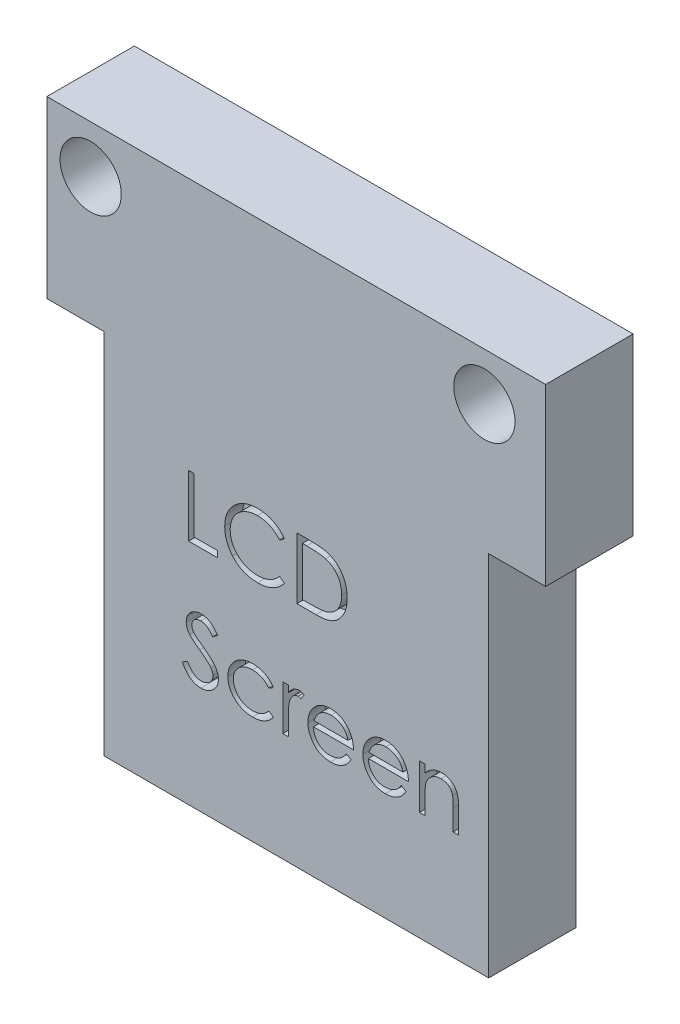
from build123d import *

# Parameters (mm, degrees)
SKETCH1_R           = 1.75
BOSS_EXTRUDE1_DEPTH = 5
CUT_EXTRUDE1_DEPTH  = 1


with BuildPart() as part:
    # Sketch1 → Boss-Extrude1 (new body)
    with BuildSketch(Plane.XY):
        Polygon((14.25, 15.5), (-14.25, 15.5), (-14.25, 5.5), (-11, 5.5), (-11, -15.5), (11, -15.5), (11, 5.5), (14.25, 5.5), align=None)
        with Locations((-11.75, 12.780701754)):
            Circle(SKETCH1_R, mode=Mode.SUBTRACT)
        with Locations((10.75, 12.780701754)):
            Circle(SKETCH1_R, mode=Mode.SUBTRACT)
    extrude(amount=BOSS_EXTRUDE1_DEPTH)

    # Sketch2 → Cut-Extrude1 (cut)
    # profile 1 of 9: a face of its own
    with BuildSketch(Plane.XY.offset(5)):
        Polygon((-6.152812215, 1.046333922), (-5.838709651, 1.046333922), (-5.838709651, -2.094691719), (-4.492555804, -2.094691719), (-4.492555804, -2.453666078), (-6.152812215, -2.453666078), align=None)
    # profile 2 of 9: a face of its own
    with BuildSketch(Plane.XY.offset(5)):
        with BuildLine():
            Line((-0.67845324, 0.404106357), (-0.953292984, 0.193769819))
            add(Edge.make_bspline(
                [(-0.953292984, 0.193769819), (-0.972898872, 0.217135789), (-1.011846319, 0.263552705), (-1.074505522, 0.328732249), (-1.139807164, 0.38979751), (-1.207726286, 0.44703939), (-1.279485405, 0.498456156), (-1.353346204, 0.546727259), (-1.430544249, 0.589994997), (-1.537295984, 0.642457983), (-1.676943832, 0.697204138), (-1.852738671, 0.743107369), (-2.03624977, 0.772328545), (-2.161447369, 0.775493386), (-2.22512792, 0.777103152)],
                knots=[0, 0, 0, 0, 0.757959112, 1.505699292, 2.245454638, 2.979532153, 3.711538275, 4.438200793, 5.171680507, 5.909471876, 7.393775596, 8.890124382, 10.418191784, 12, 12, 12, 12], degree=3))
            add(Edge.make_bspline(
                [(-2.22512792, 0.777103152), (-2.260211219, 0.77669919), (-2.330052212, 0.775895014), (-2.433700685, 0.765285889), (-2.535413736, 0.750374679), (-2.635125203, 0.728249356), (-2.732708161, 0.700276736), (-2.828800563, 0.666851323), (-2.922011163, 0.625496483), (-3.013629401, 0.579788223), (-3.101408612, 0.528160778), (-3.18446366, 0.471847426), (-3.262491628, 0.41147833), (-3.33555424, 0.346827223), (-3.403726188, 0.278185263), (-3.466513499, 0.204820921), (-3.523698909, 0.126968748), (-3.576415934, 0.04565534), (-3.623628668, -0.038882452), (-3.663158547, -0.126957522), (-3.698163669, -0.217061625), (-3.725862912, -0.310212786), (-3.747787429, -0.405755552), (-3.762915092, -0.50394634), (-3.773403563, -0.604580019), (-3.77420374, -0.672789332), (-3.774607086, -0.707171687)],
                knots=[0, 0, 0, 0, 1.054917814, 2.100044995, 3.131103042, 4.146048494, 5.169673617, 6.183595914, 7.203665975, 8.234915748, 9.262203917, 10.264457458, 11.251630812, 12.227803204, 13.197192746, 14.159520551, 15.12972552, 16.100847026, 17.073214652, 18.039054194, 19.002613845, 19.979014051, 20.95965708, 21.949030935, 22.966165397, 24, 24, 24, 24], degree=3))
            add(Edge.make_bspline(
                [(-3.774607086, -0.707171687), (-3.773345267, -0.758903007), (-3.770867853, -0.860470592), (-3.748819519, -1.009241203), (-3.715314428, -1.151761876), (-3.665098851, -1.287141719), (-3.6031798, -1.417050077), (-3.524939189, -1.53928893), (-3.434322651, -1.655705495), (-3.330048232, -1.763548443), (-3.215642416, -1.862062168), (-3.092894504, -1.948812749), (-2.962110217, -2.021127632), (-2.824733586, -2.081303578), (-2.679707472, -2.127560306), (-2.52729267, -2.160124429), (-2.367820675, -2.18136661), (-2.258851275, -2.183400298), (-2.203393144, -2.184435309)],
                knots=[0, 0, 0, 0, 1.029171465, 2.020641659, 2.987623507, 3.938342917, 4.889210282, 5.84687017, 6.821220943, 7.821438502, 8.827599549, 9.822697543, 10.807740252, 11.797342354, 12.80366471, 13.83203677, 14.896651826, 16, 16, 16, 16], degree=3))
            add(Edge.make_bspline(
                [(-2.203393144, -2.184435309), (-2.142290455, -2.182746529), (-2.022025746, -2.179422607), (-1.84565772, -2.151263358), (-1.676821954, -2.10560544), (-1.515509368, -2.041707518), (-1.362174721, -1.95864223), (-1.216578061, -1.857944352), (-1.078596491, -1.73865602), (-0.995625208, -1.647572891), (-0.953292984, -1.601101976)],
                knots=[0, 0, 0, 0, 1.028121516, 2.023589091, 2.998037872, 3.967518031, 4.937445131, 5.927275754, 6.942489185, 8, 8, 8, 8], degree=3))
            Line((-0.953292984, -1.601101976), (-0.67845324, -1.809335149))
            add(Edge.make_bspline(
                [(-0.67845324, -1.809335149), (-0.70057135, -1.837873601), (-0.744701625, -1.894813807), (-0.816159642, -1.975085517), (-0.89143694, -2.050589552), (-0.97109265, -2.120717174), (-1.054210441, -2.186871639), (-1.142282754, -2.24717347), (-1.234151786, -2.302464355), (-1.329506265, -2.353091279), (-1.428244878, -2.398008526), (-1.530249313, -2.436462294), (-1.635079888, -2.469587184), (-1.742741397, -2.49683912), (-1.853457154, -2.518110204), (-1.966827628, -2.532329879), (-2.083097503, -2.542071793), (-2.161538924, -2.542959709), (-2.201289779, -2.543409668)],
                knots=[0, 0, 0, 0, 0.986787822, 1.968848986, 2.935600012, 3.899624008, 4.868462664, 5.837806735, 6.815139263, 7.798259679, 8.787526145, 9.778297419, 10.776456485, 11.791383307, 12.812564526, 13.85620153, 14.913611965, 16, 16, 16, 16], degree=3))
            add(Edge.make_bspline(
                [(-2.201289779, -2.543409668), (-2.238933446, -2.543147676), (-2.313369136, -2.542629618), (-2.423267888, -2.53423745), (-2.530257468, -2.522787713), (-2.634032094, -2.505547582), (-2.735158069, -2.485203242), (-2.832718654, -2.457931986), (-2.927673864, -2.427382819), (-3.019642205, -2.391477832), (-3.108701905, -2.35096165), (-3.194565716, -2.305170091), (-3.277194148, -2.254488226), (-3.357399569, -2.200033216), (-3.433997153, -2.140055914), (-3.507650678, -2.075389279), (-3.578773154, -2.006251269), (-3.622775839, -1.956396415), (-3.644899554, -1.931330341)],
                knots=[0, 0, 0, 0, 1.114604814, 2.203992996, 3.262667896, 4.300477797, 5.318619304, 6.316056647, 7.298880507, 8.271930387, 9.238335007, 10.195173496, 11.151986948, 12.108099108, 13.064862484, 14.031167946, 15.010108607, 16, 16, 16, 16], degree=3))
            add(Edge.make_bspline(
                [(-3.644899554, -1.931330341), (-3.680335198, -1.887789152), (-3.750778675, -1.801232442), (-3.840904358, -1.660946461), (-3.918051913, -1.514478252), (-3.980427834, -1.361058323), (-4.029190567, -1.201030936), (-4.062971762, -1.034315421), (-4.084923367, -0.861067479), (-4.087433656, -0.74323069), (-4.088709651, -0.683333546)],
                knots=[0, 0, 0, 0, 0.994628077, 1.977248131, 2.950237994, 3.925870899, 4.908910175, 5.911660606, 6.938484602, 8, 8, 8, 8], degree=3))
            add(Edge.make_bspline(
                [(-4.088709651, -0.683333546), (-4.087154457, -0.620378093), (-4.084094711, -0.496517168), (-4.058098915, -0.314743215), (-4.016280119, -0.140591816), (-3.95688323, 0.025611928), (-3.881577879, 0.184742209), (-3.788551265, 0.335583414), (-3.678884123, 0.479100213), (-3.553436555, 0.613114965), (-3.41586922, 0.735654317), (-3.268550406, 0.843460521), (-3.111768459, 0.933178037), (-2.947250608, 1.008174199), (-2.773764926, 1.065818662), (-2.591681557, 1.106171849), (-2.401342642, 1.131288965), (-2.271480216, 1.134464173), (-2.20549651, 1.136077511)],
                knots=[0, 0, 0, 0, 1.032925535, 2.032216505, 3.007276963, 3.968222605, 4.92396291, 5.891752235, 6.871517503, 7.883894988, 8.900124299, 9.891468569, 10.874487609, 11.85992873, 12.854644235, 13.869047385, 14.917252991, 16, 16, 16, 16], degree=3))
            add(Edge.make_bspline(
                [(-2.20549651, 1.136077511), (-2.165282038, 1.135595373), (-2.08568154, 1.134641029), (-1.967928888, 1.125334887), (-1.853286561, 1.109821281), (-1.741675579, 1.088705211), (-1.632552963, 1.06249789), (-1.526752722, 1.028357591), (-1.423654035, 0.98932106), (-1.323907127, 0.944362594), (-1.227990577, 0.893895853), (-1.135934258, 0.838480229), (-1.048469399, 0.778184423), (-0.964980551, 0.713521248), (-0.88686434, 0.643122689), (-0.811902861, 0.568925093), (-0.742641783, 0.488791269), (-0.699888588, 0.432386335), (-0.67845324, 0.404106357)],
                knots=[0, 0, 0, 0, 1.096760587, 2.17092713, 3.219439832, 4.250915756, 5.268269357, 6.278326846, 7.281116186, 8.274029601, 9.260640565, 10.235837813, 11.203064059, 12.156899882, 13.114053108, 14.069676657, 15.032185724, 16, 16, 16, 16], degree=3))
        make_face()
    # profile 3 of 9: a face of its own
    with BuildSketch(Plane.XY.offset(5)):
        with BuildLine():
            Line((0.039495478, -2.453666078), (0.039495478, 1.046333922))
            Line((0.039495478, 1.046333922), (0.746226247, 1.046333922))
            add(Edge.make_bspline(
                [(0.746226247, 1.046333922), (0.807695235, 1.045891352), (0.926453, 1.045036309), (1.098065448, 1.039614918), (1.25684921, 1.030024452), (1.402282069, 1.016054926), (1.534763281, 0.998901892), (1.65392189, 0.977401488), (1.760374032, 0.952013317), (1.825843473, 0.930367867), (1.85680317, 0.920131999)],
                knots=[0, 0, 0, 0, 1.314313732, 2.53924729, 3.670748893, 4.714932338, 5.66265055, 6.526160246, 7.303039223, 8, 8, 8, 8], degree=3))
            add(Edge.make_bspline(
                [(1.85680317, 0.920131999), (1.897297909, 0.904701293), (1.977369102, 0.874189799), (2.091376224, 0.816633497), (2.198701587, 0.751420396), (2.299920732, 0.678464533), (2.392721558, 0.595700185), (2.480729455, 0.506643099), (2.560344179, 0.408054759), (2.633252475, 0.301979771), (2.698988134, 0.189667718), (2.756127292, 0.07133261), (2.803581286, -0.052424598), (2.842974512, -0.181259746), (2.87402097, -0.315456124), (2.895202901, -0.45516999), (2.909173891, -0.59984918), (2.910577943, -0.698023643), (2.911290349, -0.747836751)],
                knots=[0, 0, 0, 0, 0.984719456, 1.947108742, 2.898477687, 3.838006223, 4.779231079, 5.722358779, 6.681677486, 7.655904652, 8.64651281, 9.637519902, 10.640069247, 11.656948941, 12.698408672, 13.768548281, 14.867775369, 16, 16, 16, 16], degree=3))
            add(Edge.make_bspline(
                [(2.911290349, -0.747836751), (2.910661382, -0.79109799), (2.909421936, -0.876348779), (2.89829262, -1.001989675), (2.8821163, -1.123903246), (2.857072102, -1.241508946), (2.826669589, -1.355837164), (2.787705437, -1.465669408), (2.743069941, -1.572013217), (2.691020063, -1.673430693), (2.633878678, -1.769514066), (2.572556934, -1.860089594), (2.507120239, -1.943864816), (2.436944606, -2.021093428), (2.36293689, -2.091659006), (2.284612559, -2.156151021), (2.201769508, -2.213307576), (2.114778786, -2.265374685), (2.021102656, -2.31079504), (1.91896679, -2.34922505), (1.807935612, -2.381071665), (1.688281655, -2.407642561), (1.559798178, -2.428719864), (1.422359212, -2.442846256), (1.276175922, -2.452399189), (1.175796657, -2.453235582), (1.124130894, -2.453666078)],
                knots=[0, 0, 0, 0, 1.105936401, 2.179363191, 3.223086493, 4.248585256, 5.251745608, 6.245858792, 7.225916811, 8.198733463, 9.158002045, 10.082870192, 10.993790845, 11.873723703, 12.748670949, 13.606408763, 14.465103618, 15.319838547, 16.196477973, 17.123216899, 18.106603292, 19.147568657, 20.255746949, 21.433717677, 22.679120308, 24, 24, 24, 24], degree=3))
            Line((1.124130894, -2.453666078), (0.039495478, -2.453666078))
        make_face()
        with BuildLine():
            Line((0.353598042, -2.094691719), (0.75534083, -2.094691719))
            add(Edge.make_bspline(
                [(0.75534083, -2.094691719), (0.813069201, -2.094443623), (0.924101999, -2.093966443), (1.083759997, -2.08977924), (1.229639393, -2.082937302), (1.361760903, -2.073362224), (1.480049927, -2.060693609), (1.584753677, -2.046568707), (1.675528935, -2.028971256), (1.730458372, -2.013020296), (1.755841632, -2.005649251)],
                knots=[0, 0, 0, 0, 1.375205317, 2.645023457, 3.804390687, 4.853969522, 5.800190428, 6.637939096, 7.370582563, 8, 8, 8, 8], degree=3))
            add(Edge.make_bspline(
                [(1.755841632, -2.005649251), (1.787789994, -1.994397693), (1.850923632, -1.97216332), (1.941804717, -1.931605659), (2.026561722, -1.883563589), (2.106671747, -1.830161315), (2.180998402, -1.769515313), (2.250422519, -1.702944324), (2.31480432, -1.630109549), (2.373478628, -1.551101388), (2.425986932, -1.466411592), (2.471458161, -1.376872758), (2.511309693, -1.283465948), (2.542588286, -1.184756789), (2.56710387, -1.081627731), (2.584468558, -0.974071518), (2.595283282, -0.862108236), (2.59654473, -0.785956112), (2.597187785, -0.74713563)],
                knots=[0, 0, 0, 0, 0.998632004, 1.973411704, 2.929992603, 3.868527914, 4.809262121, 5.754881198, 6.702106254, 7.672490631, 8.653608572, 9.636854334, 10.631411391, 11.644891563, 12.686317036, 13.754757253, 14.855430412, 16, 16, 16, 16], degree=3))
            add(Edge.make_bspline(
                [(2.597187785, -0.74713563), (2.596674498, -0.706202149), (2.59566614, -0.625787965), (2.58299183, -0.50779727), (2.564470275, -0.394316619), (2.537686588, -0.285338424), (2.50355571, -0.180650072), (2.460961068, -0.080830561), (2.412294449, 0.015174307), (2.354391112, 0.105148673), (2.290975518, 0.190241782), (2.220597639, 0.268196698), (2.144375601, 0.339190998), (2.063140751, 0.404330311), (1.974603652, 0.460993987), (1.880849961, 0.511680668), (1.78050429, 0.554696559), (1.710691594, 0.577575422), (1.675212625, 0.589202511)],
                knots=[0, 0, 0, 0, 1.122418816, 2.205001699, 3.251619955, 4.274784885, 5.280384055, 6.268708349, 7.249350384, 8.229342522, 9.199999885, 10.157847722, 11.105861043, 12.055065948, 13.010012805, 13.98527497, 14.976112212, 16, 16, 16, 16], degree=3))
            add(Edge.make_bspline(
                [(1.675212625, 0.589202511), (1.645861479, 0.597318939), (1.583452888, 0.614576692), (1.481613424, 0.633402064), (1.366998275, 0.650006563), (1.239098574, 0.664064603), (1.098060115, 0.674151924), (0.943774427, 0.681723239), (0.776174822, 0.686829871), (0.659992288, 0.687178578), (0.599691792, 0.687359563)],
                knots=[0, 0, 0, 0, 0.674548936, 1.434276114, 2.292660221, 3.240891867, 4.284742987, 5.42552168, 6.663806718, 8, 8, 8, 8], degree=3))
            Line((0.599691792, 0.687359563), (0.353598042, 0.687359563))
            Line((0.353598042, 0.687359563), (0.353598042, -2.094691719))
        make_face(mode=Mode.SUBTRACT)
    # profile 4 of 9: a face of its own
    with BuildSketch(Plane.XY.offset(5)):
        with BuildLine():
            Line((-6.511786574, -8.611819123), (-6.215913176, -8.434435309))
            add(Edge.make_bspline(
                [(-6.215913176, -8.434435309), (-6.188394939, -8.480499694), (-6.135671058, -8.568757278), (-6.047719699, -8.688015318), (-5.956586788, -8.789377475), (-5.861597454, -8.872254083), (-5.763331506, -8.93750297), (-5.661147453, -8.983705201), (-5.555389642, -9.012521177), (-5.48341582, -9.016021263), (-5.447483689, -9.017768643)],
                knots=[0, 0, 0, 0, 1.272034388, 2.437168799, 3.508375237, 4.49857839, 5.41946034, 6.295179144, 7.148887113, 8, 8, 8, 8], degree=3))
            add(Edge.make_bspline(
                [(-5.447483689, -9.017768643), (-5.416796828, -9.01691397), (-5.355960055, -9.01521958), (-5.266397812, -8.998938778), (-5.17941601, -8.973926649), (-5.096807372, -8.938105717), (-5.019711758, -8.894767232), (-4.952105063, -8.842421054), (-4.893658949, -8.783814848), (-4.845849835, -8.718432194), (-4.8091698, -8.648115045), (-4.780977731, -8.575939094), (-4.765332658, -8.500770525), (-4.762975904, -8.450160063), (-4.761786574, -8.424619604)],
                knots=[0, 0, 0, 0, 1.095163259, 2.171163733, 3.241058638, 4.321873601, 5.38011039, 6.391990106, 7.366004449, 8.327778327, 9.272591725, 10.192022065, 11.087607919, 12, 12, 12, 12], degree=3))
            add(Edge.make_bspline(
                [(-4.761786574, -8.424619604), (-4.763260884, -8.395478754), (-4.766257943, -8.336239665), (-4.791589423, -8.248840012), (-4.831438669, -8.162347442), (-4.868201313, -8.108846177), (-4.887287375, -8.081069925)],
                knots=[0, 0, 0, 0, 0.938893495, 1.908633276, 2.914225137, 4, 4, 4, 4], degree=3))
            add(Edge.make_bspline(
                [(-4.887287375, -8.081069925), (-4.902957989, -8.061023101), (-4.935856483, -8.018937302), (-4.992413996, -7.956292067), (-5.05878011, -7.891673648), (-5.132683665, -7.822614591), (-5.216816754, -7.752326794), (-5.308544268, -7.677458516), (-5.410208127, -7.600856939), (-5.481507624, -7.549484374), (-5.51829699, -7.522976976)],
                knots=[0, 0, 0, 0, 0.722233717, 1.516239348, 2.393582979, 3.351407094, 4.387010283, 5.505090956, 6.712668013, 8, 8, 8, 8], degree=3))
            add(Edge.make_bspline(
                [(-5.51829699, -7.522976976), (-5.555120986, -7.496748388), (-5.625525663, -7.446601326), (-5.723984245, -7.372177042), (-5.812028708, -7.304133172), (-5.889267725, -7.24182916), (-5.955667322, -7.185256556), (-6.011750733, -7.134958616), (-6.05608929, -7.089575056), (-6.080744871, -7.060133714), (-6.091814618, -7.046915277)],
                knots=[0, 0, 0, 0, 1.452282411, 2.77665338, 3.964542531, 5.026858415, 5.96415736, 6.766646006, 7.446254459, 8, 8, 8, 8], degree=3))
            add(Edge.make_bspline(
                [(-6.091814618, -7.046915277), (-6.107287164, -7.02631424), (-6.137716, -6.985799537), (-6.177882006, -6.922474679), (-6.212021169, -6.857651413), (-6.238783501, -6.791155549), (-6.26131972, -6.72392062), (-6.27647765, -6.655069374), (-6.285969047, -6.584910756), (-6.286941034, -6.537697255), (-6.287427599, -6.514062713)],
                knots=[0, 0, 0, 0, 1.068054152, 2.10047183, 3.106115577, 4.101338837, 5.06977816, 6.043150881, 7.020423561, 8, 8, 8, 8], degree=3))
            add(Edge.make_bspline(
                [(-6.287427599, -6.514062713), (-6.28612239, -6.477032938), (-6.28353987, -6.403764875), (-6.261699353, -6.296734044), (-6.227226459, -6.194547627), (-6.178931571, -6.098217293), (-6.116674218, -6.010251312), (-6.044628244, -5.929637825), (-5.958816758, -5.861869243), (-5.864664135, -5.802657185), (-5.761607763, -5.75631126), (-5.653616859, -5.721350279), (-5.540519787, -5.701541022), (-5.463916652, -5.698698257), (-5.425047792, -5.697255822)],
                knots=[0, 0, 0, 0, 1.005424448, 1.989358655, 2.955360095, 3.929531133, 4.905563448, 5.876582895, 6.856512386, 7.866279853, 8.892233794, 9.918561126, 10.94386622, 12, 12, 12, 12], degree=3))
            add(Edge.make_bspline(
                [(-5.425047792, -5.697255822), (-5.383803691, -5.698678374), (-5.30178234, -5.701507375), (-5.181133124, -5.726104906), (-5.064972408, -5.766805578), (-4.971529143, -5.812994236), (-4.898396381, -5.859125652), (-4.842623649, -5.901145476), (-4.786106198, -5.949520584), (-4.728388143, -6.00437983), (-4.670447484, -6.066226582), (-4.611424031, -6.13463727), (-4.551179762, -6.209193826), (-4.512423902, -6.262418327), (-4.492555804, -6.289703739)],
                knots=[0, 0, 0, 0, 1.286793592, 2.559021753, 3.825965368, 5.121522368, 5.803751409, 6.523245864, 7.299691795, 8.125521123, 9.008227632, 9.944561021, 10.946284179, 12, 12, 12, 12], degree=3))
            Line((-4.492555804, -6.289703739), (-4.776510131, -6.50494813))
            add(Edge.make_bspline(
                [(-4.776510131, -6.50494813), (-4.793656064, -6.482859439), (-4.826675121, -6.440321786), (-4.876804608, -6.38075047), (-4.924053256, -6.326333991), (-4.970603655, -6.279068863), (-5.013997287, -6.23636673), (-5.056114329, -6.199806973), (-5.09634868, -6.169031377), (-5.147065591, -6.136187817), (-5.210783309, -6.103631314), (-5.290767846, -6.076082236), (-5.374354121, -6.059527174), (-5.431283752, -6.057338286), (-5.460103881, -6.056230181)],
                knots=[0, 0, 0, 0, 1.181633172, 2.275549214, 3.290209073, 4.226197932, 5.078386478, 5.862611352, 6.581680152, 7.217281963, 8.414376989, 9.595101626, 10.782541182, 12, 12, 12, 12], degree=3))
            add(Edge.make_bspline(
                [(-5.460103881, -6.056230181), (-5.496260404, -6.057441881), (-5.565984851, -6.05977853), (-5.664975087, -6.085298515), (-5.754069012, -6.125480376), (-5.830621577, -6.181795354), (-5.894358554, -6.248516347), (-5.940464013, -6.325295202), (-5.968214178, -6.410077604), (-5.971600457, -6.469219261), (-5.973325035, -6.499339155)],
                knots=[0, 0, 0, 0, 1.14458467, 2.207223713, 3.21896685, 4.227309161, 5.202851033, 6.127160689, 7.046193047, 8, 8, 8, 8], degree=3))
            add(Edge.make_bspline(
                [(-5.973325035, -6.499339155), (-5.972931909, -6.518090634), (-5.972145012, -6.555624253), (-5.961170215, -6.611075675), (-5.947070886, -6.666387015), (-5.924728254, -6.721309598), (-5.89388295, -6.776803957), (-5.853377774, -6.833825694), (-5.802364462, -6.892877403), (-5.76328745, -6.931284777), (-5.742655965, -6.951562713)],
                knots=[0, 0, 0, 0, 0.858281714, 1.717966888, 2.583508476, 3.4729293, 4.427298488, 5.488583878, 6.674047936, 8, 8, 8, 8], degree=3))
            add(Edge.make_bspline(
                [(-5.742655965, -6.951562713), (-5.734994592, -6.958399739), (-5.716792925, -6.974642947), (-5.683516999, -7.001235228), (-5.639574201, -7.034038), (-5.586112, -7.074625317), (-5.522144638, -7.121706779), (-5.447665082, -7.174680391), (-5.363503549, -7.23526585), (-5.303781633, -7.27762339), (-5.27220324, -7.300020245)],
                knots=[0, 0, 0, 0, 0.420754252, 0.999615792, 1.744751191, 2.668019286, 3.750313428, 4.999500688, 6.413464383, 8, 8, 8, 8], degree=3))
            add(Edge.make_bspline(
                [(-5.27220324, -7.300020245), (-5.234217327, -7.327661605), (-5.160662871, -7.381185266), (-5.056005291, -7.461600946), (-4.961111483, -7.540248715), (-4.875648279, -7.616626322), (-4.798771371, -7.690154415), (-4.73133365, -7.761717595), (-4.67264797, -7.830803168), (-4.609468751, -7.919375744), (-4.544910932, -8.028156828), (-4.489469424, -8.161435067), (-4.454511077, -8.295231387), (-4.449939561, -8.385158224), (-4.44768401, -8.429527457)],
                knots=[0, 0, 0, 0, 1.163667725, 2.253281268, 3.268753668, 4.215851969, 5.092017293, 5.902905408, 6.650798638, 7.335211899, 8.59617414, 9.77448103, 10.901945474, 12, 12, 12, 12], degree=3))
            add(Edge.make_bspline(
                [(-4.44768401, -8.429527457), (-4.448341148, -8.460905822), (-4.449642663, -8.523053205), (-4.464603576, -8.614308282), (-4.486523242, -8.702939152), (-4.519560476, -8.787850264), (-4.559883634, -8.870595027), (-4.611049882, -8.949002927), (-4.670357566, -9.024809326), (-4.738391331, -9.095992817), (-4.812837234, -9.161339013), (-4.891520928, -9.219468075), (-4.974571201, -9.267936398), (-5.061537518, -9.30748724), (-5.152439855, -9.338420758), (-5.247247639, -9.360833627), (-5.34611715, -9.374589338), (-5.413317631, -9.376017099), (-5.447483689, -9.376743001)],
                knots=[0, 0, 0, 0, 0.983748083, 1.948392443, 2.894712957, 3.844097841, 4.80183111, 5.778335162, 6.776009319, 7.81870978, 8.863265674, 9.881300176, 10.883814829, 11.87499822, 12.874611388, 13.892143829, 14.928324115, 16, 16, 16, 16], degree=3))
            add(Edge.make_bspline(
                [(-5.447483689, -9.376743001), (-5.473919032, -9.37623182), (-5.526456792, -9.375215895), (-5.604166274, -9.366234614), (-5.680305863, -9.35352751), (-5.753920145, -9.333353441), (-5.825957557, -9.308876463), (-5.896104791, -9.278738131), (-5.964395845, -9.242620929), (-6.031213428, -9.201325905), (-6.096387603, -9.15326816), (-6.159307071, -9.097294664), (-6.222036256, -9.034949159), (-6.282723652, -8.964538595), (-6.342596797, -8.887200513), (-6.400475206, -8.802211329), (-6.457556924, -8.710033975), (-6.493372392, -8.64516889), (-6.511786574, -8.611819123)],
                knots=[0, 0, 0, 0, 0.915332311, 1.819136955, 2.706846663, 3.586547465, 4.459518054, 5.340707479, 6.227863349, 7.133153174, 8.059268498, 9.028702269, 10.047606654, 11.120612155, 12.245963614, 13.433783089, 14.680604001, 16, 16, 16, 16], degree=3))
        make_face()
    # profile 5 of 9: a face of its own
    with BuildSketch(Plane.XY.offset(5)):
        with BuildLine():
            Line((-1.306658368, -7.283894444), (-1.569579042, -7.447255822))
            add(Edge.make_bspline(
                [(-1.569579042, -7.447255822), (-1.598408907, -7.411427428), (-1.655155602, -7.340905318), (-1.753694839, -7.249895385), (-1.858706253, -7.171728343), (-1.9719843, -7.108024592), (-2.093370101, -7.058803142), (-2.222384952, -7.023972936), (-2.359010457, -7.002268693), (-2.452675656, -6.999801856), (-2.500668785, -6.998537873)],
                knots=[0, 0, 0, 0, 1.026593902, 2.0206758, 2.988051866, 3.946915611, 4.916868779, 5.907761954, 6.927957743, 8, 8, 8, 8], degree=3))
            add(Edge.make_bspline(
                [(-2.500668785, -6.998537873), (-2.539027742, -6.999594715), (-2.614574665, -7.001676137), (-2.725480818, -7.014686631), (-2.831123171, -7.038328639), (-2.93216388, -7.069479596), (-3.027884299, -7.111229886), (-3.118535217, -7.162039642), (-3.204920707, -7.221089682), (-3.284537449, -7.289500228), (-3.357366456, -7.363898895), (-3.42046537, -7.443652591), (-3.475402303, -7.526372482), (-3.518508259, -7.614124224), (-3.55378343, -7.704900277), (-3.57699015, -7.800414133), (-3.592454845, -7.899442141), (-3.594224174, -7.96696048), (-3.595119907, -8.00114204)],
                knots=[0, 0, 0, 0, 1.112346261, 2.190735716, 3.231507886, 4.247384806, 5.251966152, 6.253067467, 7.256802811, 8.280671706, 9.291813951, 10.270744147, 11.225547591, 12.165006084, 13.100104208, 14.043489273, 15.009504848, 16, 16, 16, 16], degree=3))
            add(Edge.make_bspline(
                [(-3.595119907, -8.00114204), (-3.593340655, -8.045911251), (-3.589806124, -8.134846447), (-3.562104664, -8.266124549), (-3.516760257, -8.393048239), (-3.454702407, -8.514716376), (-3.376225272, -8.627310531), (-3.284052709, -8.728293986), (-3.178133626, -8.815710014), (-3.059401295, -8.888182539), (-2.930643551, -8.946443907), (-2.793253447, -8.987951239), (-2.648353666, -9.013003612), (-2.549146919, -9.016159555), (-2.49856542, -9.017768643)],
                knots=[0, 0, 0, 0, 0.966302908, 1.919585723, 2.883856336, 3.870342332, 4.860282998, 5.839159637, 6.814385684, 7.815993281, 8.834850808, 9.858348828, 10.908058873, 12, 12, 12, 12], degree=3))
            add(Edge.make_bspline(
                [(-2.49856542, -9.017768643), (-2.452210235, -9.016469145), (-2.361109997, -9.013915288), (-2.227942712, -8.992386325), (-2.101162801, -8.957142692), (-1.98077477, -8.907995042), (-1.866998604, -8.844467526), (-1.76056943, -8.766108355), (-1.659369491, -8.675171754), (-1.599872515, -8.604853783), (-1.569579042, -8.569050694)],
                knots=[0, 0, 0, 0, 1.039848629, 2.043578496, 3.018386758, 3.987534228, 4.954977003, 5.934852016, 6.948509513, 8, 8, 8, 8], degree=3))
            Line((-1.569579042, -8.569050694), (-1.306658368, -8.741526655))
            add(Edge.make_bspline(
                [(-1.306658368, -8.741526655), (-1.322246071, -8.764417382), (-1.353369738, -8.810122859), (-1.405397363, -8.874566976), (-1.461517195, -8.934888658), (-1.521510292, -8.991007048), (-1.584593301, -9.044265067), (-1.652921211, -9.092116642), (-1.724290823, -9.137251464), (-1.79953998, -9.177864337), (-1.877890678, -9.214370658), (-1.959232668, -9.245761829), (-2.043212481, -9.272731935), (-2.129928857, -9.294169282), (-2.219552755, -9.31128012), (-2.311852389, -9.322633822), (-2.406795971, -9.331109103), (-2.470968122, -9.33161497), (-2.503473272, -9.331871207)],
                knots=[0, 0, 0, 0, 0.954134338, 1.905101784, 2.851144739, 3.791306361, 4.734911809, 5.6936923, 6.663572882, 7.643865596, 8.638447847, 9.640600242, 10.646758161, 11.676244097, 12.717260333, 13.78922464, 14.880174919, 16, 16, 16, 16], degree=3))
            add(Edge.make_bspline(
                [(-2.503473272, -9.331871207), (-2.553084156, -9.330979927), (-2.650321848, -9.329233012), (-2.792644356, -9.310024537), (-2.928658023, -9.28106692), (-3.058316381, -9.239503186), (-3.181639615, -9.185998411), (-3.298512733, -9.120641497), (-3.408548752, -9.042889707), (-3.510659534, -8.954126937), (-3.604440981, -8.857886296), (-3.684967171, -8.754036378), (-3.754812441, -8.64639533), (-3.810899985, -8.532585804), (-3.855546911, -8.414120432), (-3.886051744, -8.290050192), (-3.905781481, -8.161397938), (-3.908064861, -8.073665056), (-3.909222471, -8.029186912)],
                knots=[0, 0, 0, 0, 1.1129367, 2.181364009, 3.217532258, 4.231199276, 5.232079859, 6.230262199, 7.231623845, 8.250719726, 9.263571943, 10.242672461, 11.195837495, 12.138959767, 13.085126421, 14.0317438, 15.002148558, 16, 16, 16, 16], degree=3))
            add(Edge.make_bspline(
                [(-3.909222471, -8.029186912), (-3.908781455, -7.999008477), (-3.907904201, -7.93897859), (-3.897842273, -7.849883523), (-3.8848438, -7.761974978), (-3.862818063, -7.676367259), (-3.837377432, -7.591761968), (-3.8049019, -7.509178867), (-3.766806505, -7.428234194), (-3.723554558, -7.349136465), (-3.674865812, -7.273186925), (-3.620984579, -7.201433261), (-3.563940243, -7.133013495), (-3.501064131, -7.070289734), (-3.435024477, -7.010753543), (-3.363952901, -6.955995419), (-3.28825705, -6.905854428), (-3.209073727, -6.859403412), (-3.126449016, -6.818043977), (-3.040882346, -6.782410739), (-2.952889316, -6.751958164), (-2.862329172, -6.727849244), (-2.769802999, -6.707631821), (-2.674581661, -6.694913975), (-2.577029439, -6.685927702), (-2.510973416, -6.68493691), (-2.477531766, -6.684435309)],
                knots=[0, 0, 0, 0, 0.990994727, 1.971252077, 2.943264845, 3.907940874, 4.872158414, 5.844625996, 6.82015047, 7.809835459, 8.804511986, 9.781214284, 10.756496977, 11.728388426, 12.696359165, 13.676225489, 14.672885716, 15.677705647, 16.690706858, 17.706033469, 18.721040654, 19.747369689, 20.783475414, 21.830280724, 22.901553713, 24, 24, 24, 24], degree=3))
            add(Edge.make_bspline(
                [(-2.477531766, -6.684435309), (-2.435651658, -6.6853572), (-2.352100778, -6.687196374), (-2.228160072, -6.702675027), (-2.106044878, -6.726011443), (-1.987897774, -6.760584273), (-1.87515126, -6.802447928), (-1.76961581, -6.849460643), (-1.673775706, -6.904055246), (-1.585848117, -6.963775361), (-1.505668599, -7.031136266), (-1.432414107, -7.106943224), (-1.364582457, -7.190801703), (-1.326125746, -7.252607434), (-1.306658368, -7.283894444)],
                knots=[0, 0, 0, 0, 1.095225653, 2.184976855, 3.262915854, 4.344593502, 5.400796181, 6.407717688, 7.363229445, 8.282371371, 9.184954523, 10.097238608, 11.036792983, 12, 12, 12, 12], degree=3))
        make_face()
    # profile 6 of 9: a face of its own
    with BuildSketch(Plane.XY.offset(5)):
        with BuildLine():
            Line((-0.76819683, -6.729307104), (-0.454094266, -6.729307104))
            Line((-0.454094266, -6.729307104), (-0.454094266, -7.105809508))
            add(Edge.make_bspline(
                [(-0.454094266, -7.105809508), (-0.430905507, -7.07075368), (-0.386557186, -7.00370968), (-0.312844257, -6.915040379), (-0.237340926, -6.841625333), (-0.159685738, -6.783121814), (-0.079307638, -6.739308695), (0.002029313, -6.70721566), (0.085604783, -6.688238345), (0.141766707, -6.685704686), (0.169904132, -6.684435309)],
                knots=[0, 0, 0, 0, 1.2804753, 2.448899062, 3.506932113, 4.484331642, 5.4025378, 6.288909075, 7.142734305, 8, 8, 8, 8], degree=3))
            add(Edge.make_bspline(
                [(0.169904132, -6.684435309), (0.191730458, -6.685625836), (0.236639543, -6.688075422), (0.304622133, -6.705286246), (0.374665585, -6.732764269), (0.419807972, -6.758604491), (0.443341632, -6.772075534)],
                knots=[0, 0, 0, 0, 0.901110191, 1.854092781, 2.881294221, 4, 4, 4, 4], degree=3))
            Line((0.443341632, -6.772075534), (0.27086567, -7.04411079))
            add(Edge.make_bspline(
                [(0.27086567, -7.04411079), (0.255756649, -7.037370524), (0.227076834, -7.024576208), (0.185122268, -7.009434198), (0.146440931, -7.000518282), (0.121797373, -6.999167565), (0.110308779, -6.998537873)],
                knots=[0, 0, 0, 0, 1.180555205, 2.24091978, 3.179933427, 4, 4, 4, 4], degree=3))
            add(Edge.make_bspline(
                [(0.110308779, -6.998537873), (0.085103045, -7.000217911), (0.033690655, -7.0036447), (-0.041793844, -7.030583508), (-0.115041049, -7.074108748), (-0.173212712, -7.12237986), (-0.218254965, -7.168927657), (-0.25039519, -7.20957606), (-0.279877937, -7.255154691), (-0.308048158, -7.304884375), (-0.333714452, -7.359614221), (-0.357669121, -7.418797434), (-0.379327984, -7.482502563), (-0.391678228, -7.526885083), (-0.398004522, -7.549619604)],
                knots=[0, 0, 0, 0, 1.125678352, 2.296057538, 3.5422874, 4.923748041, 5.663163013, 6.437101912, 7.23742474, 8.08941207, 8.991984279, 9.93940061, 10.944477711, 12, 12, 12, 12], degree=3))
            add(Edge.make_bspline(
                [(-0.398004522, -7.549619604), (-0.402736916, -7.569896778), (-0.413218807, -7.614809176), (-0.423410345, -7.690157701), (-0.433479863, -7.77918136), (-0.440576482, -7.882127953), (-0.447154524, -7.998740397), (-0.450864606, -8.129196342), (-0.453967746, -8.273629693), (-0.454050813, -8.374604047), (-0.454094266, -8.427424091)],
                knots=[0, 0, 0, 0, 0.566838948, 1.255505196, 2.06880316, 3.007127437, 4.065329342, 5.249902469, 6.561414163, 8, 8, 8, 8], degree=3))
            Line((-0.454094266, -8.427424091), (-0.454094266, -9.286999412))
            Line((-0.454094266, -9.286999412), (-0.76819683, -9.286999412))
            Line((-0.76819683, -9.286999412), (-0.76819683, -6.729307104))
        make_face()
    # profile 7 of 9: a face of its own
    with BuildSketch(Plane.XY.offset(5)):
        with BuildLine():
            Line((2.856602849, -8.479307104), (3.135649324, -8.625841559))
            add(Edge.make_bspline(
                [(3.135649324, -8.625841559), (3.113412729, -8.66528489), (3.07014912, -8.742025993), (2.995748372, -8.847457854), (2.9177563, -8.94230557), (2.832652332, -9.024035224), (2.742982653, -9.095286609), (2.648249998, -9.157624434), (2.54796118, -9.210742954), (2.442111455, -9.255495482), (2.329811904, -9.289904976), (2.210790388, -9.314209197), (2.084818892, -9.329232465), (1.998472713, -9.330977606), (1.954259099, -9.331871207)],
                knots=[0, 0, 0, 0, 1.120438281, 2.179929193, 3.190490725, 4.156257408, 5.095198341, 6.022838206, 6.959905092, 7.901321166, 8.864066838, 9.862729781, 10.905609505, 12, 12, 12, 12], degree=3))
            add(Edge.make_bspline(
                [(1.954259099, -9.331871207), (1.905117122, -9.330724031), (1.80925536, -9.328486225), (1.669715613, -9.30919376), (1.538336195, -9.277721401), (1.415124491, -9.23375586), (1.300382239, -9.176328536), (1.193881384, -9.106369054), (1.095061858, -9.024236799), (1.007037649, -8.929220356), (0.927793766, -8.827538399), (0.857867946, -8.721582514), (0.799410515, -8.61161929), (0.751857905, -8.498348766), (0.71345304, -8.382484872), (0.686686336, -8.262973404), (0.671256588, -8.14013782), (0.668892143, -8.057040485), (0.667700606, -8.015164476)],
                knots=[0, 0, 0, 0, 1.145258523, 2.234067595, 3.276747158, 4.290159414, 5.277019952, 6.260822364, 7.254936242, 8.264827045, 9.274100331, 10.257902744, 11.220704747, 12.172965371, 13.118907548, 14.062713208, 15.023725156, 16, 16, 16, 16], degree=3))
            add(Edge.make_bspline(
                [(0.667700606, -8.015164476), (0.668759747, -7.975869645), (0.670858825, -7.897992481), (0.684089613, -7.782726936), (0.707537906, -7.670698484), (0.73971423, -7.561814036), (0.781265476, -7.456255902), (0.832097695, -7.353959838), (0.892290073, -7.255034698), (0.938762747, -7.192631565), (0.96217176, -7.16119813)],
                knots=[0, 0, 0, 0, 1.024358464, 2.0301432, 3.019427413, 4.004406732, 4.986367066, 5.972626655, 6.978780325, 8, 8, 8, 8], degree=3))
            add(Edge.make_bspline(
                [(0.96217176, -7.16119813), (0.993879442, -7.12332926), (1.056290389, -7.048791109), (1.161846744, -6.950852783), (1.276146941, -6.868809008), (1.397758567, -6.800801872), (1.528095041, -6.749128225), (1.665404332, -6.710620643), (1.811249918, -6.689042632), (1.910955139, -6.685994798), (1.961971439, -6.684435309)],
                knots=[0, 0, 0, 0, 1.030682036, 2.02871468, 2.997146059, 3.962720338, 4.930598197, 5.918074684, 6.934738563, 8, 8, 8, 8], degree=3))
            add(Edge.make_bspline(
                [(1.961971439, -6.684435309), (2.014419045, -6.685789358), (2.11730929, -6.688445693), (2.267341411, -6.713072027), (2.409302128, -6.752124581), (2.543134632, -6.807278372), (2.668852493, -6.878437924), (2.785638543, -6.966579765), (2.895490055, -7.068997852), (2.959398634, -7.147761062), (2.991919356, -7.187840758)],
                knots=[0, 0, 0, 0, 1.056321875, 2.072262726, 3.055038591, 4.01806755, 4.982017516, 5.957941055, 6.960871419, 8, 8, 8, 8], degree=3))
            add(Edge.make_bspline(
                [(2.991919356, -7.187840758), (3.014046294, -7.218044339), (3.058152887, -7.278250458), (3.113399987, -7.376421615), (3.161357382, -7.479132209), (3.199690343, -7.588042507), (3.230729845, -7.701862087), (3.253186663, -7.821404631), (3.266356282, -7.946634543), (3.268944979, -8.031961098), (3.270264708, -8.07546095)],
                knots=[0, 0, 0, 0, 0.94817472, 1.890038105, 2.849395472, 3.817997239, 4.812318967, 5.836947057, 6.897266129, 8, 8, 8, 8], degree=3))
            Line((3.270264708, -8.07546095), (0.98180317, -8.07546095))
            add(Edge.make_bspline(
                [(0.98180317, -8.07546095), (0.983342776, -8.109161414), (0.98637035, -8.175432018), (1.000485494, -8.272402801), (1.022734267, -8.364776143), (1.05400333, -8.451859185), (1.091870175, -8.534789313), (1.138255892, -8.61295135), (1.193595446, -8.68598928), (1.255321145, -8.754556418), (1.324028241, -8.815617179), (1.396310988, -8.870268955), (1.473204553, -8.916074552), (1.554102636, -8.953254441), (1.638874421, -8.982360757), (1.727546617, -9.002228578), (1.819944733, -9.015535685), (1.882930467, -9.01701535), (1.914996279, -9.017768643)],
                knots=[0, 0, 0, 0, 1.094153842, 2.151609401, 3.174256925, 4.172055639, 5.149267565, 6.128595816, 7.11444997, 8.118368179, 9.117203808, 10.09244225, 11.054858984, 12.015122123, 12.976791628, 13.957293641, 14.960065497, 16, 16, 16, 16], degree=3))
            add(Edge.make_bspline(
                [(1.914996279, -9.017768643), (1.946347427, -9.017160586), (2.008554117, -9.015954085), (2.101194975, -9.004222174), (2.192334502, -8.985251898), (2.281595485, -8.959361908), (2.367166331, -8.927785056), (2.446411881, -8.889682198), (2.519292097, -8.847532452), (2.587409064, -8.799322777), (2.653480057, -8.74031459), (2.719022543, -8.666678869), (2.789299197, -8.579591341), (2.83328879, -8.514045675), (2.856602849, -8.479307104)],
                knots=[0, 0, 0, 0, 0.99110716, 1.966546729, 2.947904876, 3.932708344, 4.903319531, 5.828989031, 6.710028674, 7.56322171, 8.463672341, 9.504779593, 10.677557249, 12, 12, 12, 12], degree=3))
        make_face()
        with BuildLine():
            add(Edge.make_bspline(
                [(2.956162144, -7.761358386), (2.94466552, -7.719695512), (2.922538218, -7.639507892), (2.876301854, -7.528467001), (2.824230313, -7.4297791), (2.762608582, -7.344199467), (2.692789856, -7.268195954), (2.612144674, -7.201777369), (2.52170878, -7.142359918), (2.421949639, -7.092207419), (2.316307854, -7.04951756), (2.205701662, -7.020892444), (2.092843874, -7.001282902), (2.016509588, -6.999456793), (1.97809724, -6.998537873)],
                knots=[0, 0, 0, 0, 1.154881502, 2.222775134, 3.210006277, 4.132804581, 5.035138423, 5.962687519, 6.919655026, 7.923214229, 8.944639381, 9.960483929, 10.97369054, 12, 12, 12, 12], degree=3))
            add(Edge.make_bspline(
                [(1.97809724, -6.998537873), (1.946747802, -6.999149545), (1.884776553, -7.000358691), (1.793475485, -7.01182882), (1.705795786, -7.030788665), (1.621090498, -7.056753622), (1.54046963, -7.091362224), (1.462274862, -7.131945451), (1.388494465, -7.181487035), (1.34235317, -7.219245889), (1.319042753, -7.238321527)],
                knots=[0, 0, 0, 0, 1.04873581, 2.073130211, 3.073294108, 4.04793562, 5.032784715, 6.005352987, 6.992311501, 8, 8, 8, 8], degree=3))
            add(Edge.make_bspline(
                [(1.319042753, -7.238321527), (1.302349471, -7.253415843), (1.268566337, -7.283963059), (1.223425816, -7.336592265), (1.180205343, -7.393343828), (1.14087169, -7.456388952), (1.104794104, -7.525009731), (1.071034127, -7.598627366), (1.040647714, -7.677800497), (1.023551604, -7.732972936), (1.014755894, -7.761358386)],
                knots=[0, 0, 0, 0, 0.879870761, 1.780643979, 2.707998968, 3.669668524, 4.684282772, 5.740141944, 6.837334558, 8, 8, 8, 8], degree=3))
            Line((1.014755894, -7.761358386), (2.956162144, -7.761358386))
        make_face(mode=Mode.SUBTRACT)
    # profile 8 of 9: a face of its own
    with BuildSketch(Plane.XY.offset(5)):
        with BuildLine():
            Line((5.99762849, -8.479307104), (6.276674965, -8.625841559))
            add(Edge.make_bspline(
                [(6.276674965, -8.625841559), (6.25443837, -8.66528489), (6.211174761, -8.742025993), (6.136774013, -8.847457854), (6.058781941, -8.94230557), (5.973677973, -9.024035224), (5.884008294, -9.095286609), (5.789275639, -9.157624434), (5.688986821, -9.210742954), (5.583137096, -9.255495482), (5.470837545, -9.289904976), (5.351816029, -9.314209197), (5.225844533, -9.329232465), (5.139498354, -9.330977606), (5.09528474, -9.331871207)],
                knots=[0, 0, 0, 0, 1.120438281, 2.179929193, 3.190490725, 4.156257408, 5.095198341, 6.022838206, 6.959905092, 7.901321166, 8.864066838, 9.862729781, 10.905609505, 12, 12, 12, 12], degree=3))
            add(Edge.make_bspline(
                [(5.09528474, -9.331871207), (5.046142763, -9.330724031), (4.950281001, -9.328486225), (4.810741254, -9.30919376), (4.679361836, -9.277721401), (4.556150132, -9.23375586), (4.44140788, -9.176328536), (4.334907025, -9.106369054), (4.236087499, -9.024236799), (4.14806329, -8.929220356), (4.068819407, -8.827538399), (3.998893587, -8.721582514), (3.940436156, -8.61161929), (3.892883546, -8.498348766), (3.854478681, -8.382484872), (3.827711977, -8.262973404), (3.812282229, -8.14013782), (3.809917784, -8.057040485), (3.808726247, -8.015164476)],
                knots=[0, 0, 0, 0, 1.145258523, 2.234067595, 3.276747158, 4.290159414, 5.277019952, 6.260822364, 7.254936242, 8.264827045, 9.274100331, 10.257902744, 11.220704747, 12.172965371, 13.118907548, 14.062713208, 15.023725156, 16, 16, 16, 16], degree=3))
            add(Edge.make_bspline(
                [(3.808726247, -8.015164476), (3.809785388, -7.975869645), (3.811884466, -7.897992481), (3.825115254, -7.782726936), (3.848563547, -7.670698484), (3.880739871, -7.561814036), (3.922291117, -7.456255902), (3.973123336, -7.353959838), (4.033315714, -7.255034698), (4.079788388, -7.192631565), (4.103197401, -7.16119813)],
                knots=[0, 0, 0, 0, 1.024358464, 2.0301432, 3.019427413, 4.004406732, 4.986367066, 5.972626655, 6.978780325, 8, 8, 8, 8], degree=3))
            add(Edge.make_bspline(
                [(4.103197401, -7.16119813), (4.134905084, -7.12332926), (4.19731603, -7.048791109), (4.302872385, -6.950852783), (4.417172582, -6.868809008), (4.538784208, -6.800801872), (4.669120682, -6.749128225), (4.806429973, -6.710620643), (4.952275559, -6.689042632), (5.05198078, -6.685994798), (5.10299708, -6.684435309)],
                knots=[0, 0, 0, 0, 1.030682036, 2.02871468, 2.997146059, 3.962720338, 4.930598197, 5.918074684, 6.934738563, 8, 8, 8, 8], degree=3))
            add(Edge.make_bspline(
                [(5.10299708, -6.684435309), (5.155444686, -6.685789358), (5.258334931, -6.688445693), (5.408367053, -6.713072027), (5.550327769, -6.752124581), (5.684160273, -6.807278372), (5.809878134, -6.878437924), (5.926664184, -6.966579765), (6.036515696, -7.068997852), (6.100424275, -7.147761062), (6.132944997, -7.187840758)],
                knots=[0, 0, 0, 0, 1.056321875, 2.072262726, 3.055038591, 4.01806755, 4.982017516, 5.957941055, 6.960871419, 8, 8, 8, 8], degree=3))
            add(Edge.make_bspline(
                [(6.132944997, -7.187840758), (6.155071935, -7.218044339), (6.199178528, -7.278250458), (6.254425628, -7.376421615), (6.302383023, -7.479132209), (6.340715984, -7.588042507), (6.371755486, -7.701862087), (6.394212304, -7.821404631), (6.407381923, -7.946634543), (6.40997062, -8.031961098), (6.411290349, -8.07546095)],
                knots=[0, 0, 0, 0, 0.94817472, 1.890038105, 2.849395472, 3.817997239, 4.812318967, 5.836947057, 6.897266129, 8, 8, 8, 8], degree=3))
            Line((6.411290349, -8.07546095), (4.122828811, -8.07546095))
            add(Edge.make_bspline(
                [(4.122828811, -8.07546095), (4.124368417, -8.109161414), (4.127395991, -8.175432018), (4.141511135, -8.272402801), (4.163759908, -8.364776143), (4.195028971, -8.451859185), (4.232895816, -8.534789313), (4.279281533, -8.61295135), (4.334621087, -8.68598928), (4.396346786, -8.754556418), (4.465053882, -8.815617179), (4.537336629, -8.870268955), (4.614230194, -8.916074552), (4.695128277, -8.953254441), (4.779900063, -8.982360757), (4.868572258, -9.002228578), (4.960970374, -9.015535685), (5.023956108, -9.01701535), (5.05602192, -9.017768643)],
                knots=[0, 0, 0, 0, 1.094153842, 2.151609401, 3.174256925, 4.172055639, 5.149267565, 6.128595816, 7.11444997, 8.118368179, 9.117203808, 10.09244225, 11.054858984, 12.015122123, 12.976791628, 13.957293641, 14.960065497, 16, 16, 16, 16], degree=3))
            add(Edge.make_bspline(
                [(5.05602192, -9.017768643), (5.087373068, -9.017160586), (5.149579759, -9.015954085), (5.242220616, -9.004222174), (5.333360143, -8.985251898), (5.422621127, -8.959361908), (5.508191972, -8.927785056), (5.587437522, -8.889682198), (5.660317738, -8.847532452), (5.728434705, -8.799322777), (5.794505698, -8.74031459), (5.860048184, -8.666678869), (5.930324838, -8.579591341), (5.974314431, -8.514045675), (5.99762849, -8.479307104)],
                knots=[0, 0, 0, 0, 0.99110716, 1.966546729, 2.947904876, 3.932708344, 4.903319531, 5.828989031, 6.710028674, 7.56322171, 8.463672341, 9.504779593, 10.677557249, 12, 12, 12, 12], degree=3))
        make_face()
        with BuildLine():
            add(Edge.make_bspline(
                [(6.097187785, -7.761358386), (6.085691161, -7.719695512), (6.063563859, -7.639507892), (6.017327495, -7.528467001), (5.965255954, -7.4297791), (5.903634223, -7.344199467), (5.833815497, -7.268195954), (5.753170315, -7.201777369), (5.662734421, -7.142359918), (5.56297528, -7.092207419), (5.457333495, -7.04951756), (5.346727303, -7.020892444), (5.233869515, -7.001282902), (5.157535229, -6.999456793), (5.119122882, -6.998537873)],
                knots=[0, 0, 0, 0, 1.154881502, 2.222775134, 3.210006277, 4.132804581, 5.035138423, 5.962687519, 6.919655026, 7.923214229, 8.944639381, 9.960483929, 10.97369054, 12, 12, 12, 12], degree=3))
            add(Edge.make_bspline(
                [(5.119122882, -6.998537873), (5.087773443, -6.999149545), (5.025802194, -7.000358691), (4.934501126, -7.01182882), (4.846821427, -7.030788665), (4.762116139, -7.056753622), (4.681495271, -7.091362224), (4.603300503, -7.131945451), (4.529520106, -7.181487035), (4.483378811, -7.219245889), (4.460068394, -7.238321527)],
                knots=[0, 0, 0, 0, 1.04873581, 2.073130211, 3.073294108, 4.04793562, 5.032784715, 6.005352987, 6.992311501, 8, 8, 8, 8], degree=3))
            add(Edge.make_bspline(
                [(4.460068394, -7.238321527), (4.443375112, -7.253415843), (4.409591978, -7.283963059), (4.364451457, -7.336592265), (4.321230984, -7.393343828), (4.281897331, -7.456388952), (4.245819745, -7.525009731), (4.212059768, -7.598627366), (4.181673355, -7.677800497), (4.164577245, -7.732972936), (4.155781535, -7.761358386)],
                knots=[0, 0, 0, 0, 0.879870761, 1.780643979, 2.707998968, 3.669668524, 4.684282772, 5.740141944, 6.837334558, 8, 8, 8, 8], degree=3))
            Line((4.155781535, -7.761358386), (6.097187785, -7.761358386))
        make_face(mode=Mode.SUBTRACT)
    # profile 9 of 9: a face of its own
    with BuildSketch(Plane.XY.offset(5)):
        with BuildLine():
            Line((7.039495478, -6.729307104), (7.353598042, -6.729307104))
            Line((7.353598042, -6.729307104), (7.353598042, -7.190645245))
            add(Edge.make_bspline(
                [(7.353598042, -7.190645245), (7.387135677, -7.148802522), (7.452216628, -7.067605259), (7.560600961, -6.960884684), (7.675144862, -6.872939459), (7.795146865, -6.802835665), (7.920769875, -6.749989039), (8.051248145, -6.711823108), (8.187362851, -6.688938279), (8.279927288, -6.685948049), (8.326755093, -6.684435309)],
                knots=[0, 0, 0, 0, 1.12780773, 2.188550248, 3.19190651, 4.159438251, 5.104880172, 6.052711206, 7.014878035, 8, 8, 8, 8], degree=3))
            add(Edge.make_bspline(
                [(8.326755093, -6.684435309), (8.374085727, -6.686180505), (8.466723195, -6.689596273), (8.601601256, -6.716612964), (8.72757465, -6.762758219), (8.844194206, -6.82597029), (8.949321419, -6.904576763), (9.041646271, -6.996154545), (9.118009518, -7.101490628), (9.169206881, -7.199213784), (9.202932529, -7.285902579), (9.224164866, -7.360149329), (9.242195848, -7.44286748), (9.257827596, -7.533807069), (9.268404708, -7.633605259), (9.276746999, -7.741852951), (9.282725693, -7.858515082), (9.2829629, -7.939201709), (9.283085221, -7.980809508)],
                knots=[0, 0, 0, 0, 1.235846778, 2.418850247, 3.575807741, 4.728682307, 5.871620074, 6.994088408, 8.11269785, 9.256955736, 9.865816715, 10.540099792, 11.271859618, 12.076849838, 12.949306005, 13.892391288, 14.913166135, 16, 16, 16, 16], degree=3))
            Line((9.283085221, -7.980809508), (9.283085221, -9.286999412))
            Line((9.283085221, -9.286999412), (8.968982657, -9.286999412))
            Line((8.968982657, -9.286999412), (8.968982657, -8.083874412))
            add(Edge.make_bspline(
                [(8.968982657, -8.083874412), (8.968789449, -8.049051967), (8.968419875, -7.982442556), (8.967254228, -7.887073533), (8.964444422, -7.800586954), (8.960496109, -7.723189587), (8.954717078, -7.65495575), (8.948694447, -7.595746474), (8.94132947, -7.545636931), (8.934766557, -7.515471849), (8.931823202, -7.501943322)],
                knots=[0, 0, 0, 0, 1.430800155, 2.736877192, 3.918605307, 4.986035426, 5.920637409, 6.731861385, 7.431261377, 8, 8, 8, 8], degree=3))
            add(Edge.make_bspline(
                [(8.931823202, -7.501943322), (8.921197671, -7.462232137), (8.90074681, -7.385800392), (8.850212827, -7.28212604), (8.786398646, -7.193927852), (8.708500797, -7.12175113), (8.617271721, -7.065580294), (8.512964578, -7.026606339), (8.396585937, -7.00223007), (8.314731555, -6.999802938), (8.272067593, -6.998537873)],
                knots=[0, 0, 0, 0, 1.084156227, 2.086665306, 3.027808233, 3.945421172, 4.874247719, 5.839848303, 6.874090471, 8, 8, 8, 8], degree=3))
            add(Edge.make_bspline(
                [(8.272067593, -6.998537873), (8.246799909, -6.999013878), (8.196795816, -6.999955879), (8.122645845, -7.009407177), (8.050721671, -7.024865633), (7.980301462, -7.04573427), (7.912793669, -7.074396539), (7.846029377, -7.106925909), (7.782522613, -7.147474121), (7.720919216, -7.192664743), (7.663606409, -7.24274395), (7.61027807, -7.29558846), (7.56274005, -7.351864064), (7.519671375, -7.410664012), (7.482493111, -7.47279585), (7.450040023, -7.537660156), (7.422504328, -7.605342305), (7.408821636, -7.652317366), (7.401975446, -7.675821527)],
                knots=[0, 0, 0, 0, 1.023777757, 2.026029729, 3.023749952, 4.003683103, 4.997618607, 5.993177895, 7.010360494, 8.046726602, 9.087585522, 10.09234134, 11.086953743, 12.070360549, 13.043493632, 14.017870808, 15.008233677, 16, 16, 16, 16], degree=3))
            add(Edge.make_bspline(
                [(7.401975446, -7.675821527), (7.398035797, -7.69307673), (7.389459388, -7.730640405), (7.380196208, -7.792284824), (7.371788633, -7.863594799), (7.364751674, -7.944487116), (7.360446258, -8.035244991), (7.355751861, -8.135480829), (7.3540428, -8.245594317), (7.353750446, -8.32225601), (7.353598042, -8.362219764)],
                knots=[0, 0, 0, 0, 0.615963638, 1.340920617, 2.168419149, 3.115676021, 4.16674242, 5.331190069, 6.6087489, 8, 8, 8, 8], degree=3))
            Line((7.353598042, -8.362219764), (7.353598042, -9.286999412))
            Line((7.353598042, -9.286999412), (7.039495478, -9.286999412))
            Line((7.039495478, -9.286999412), (7.039495478, -6.729307104))
        make_face()
    extrude(amount=-CUT_EXTRUDE1_DEPTH, mode=Mode.SUBTRACT)


solid = part.part
